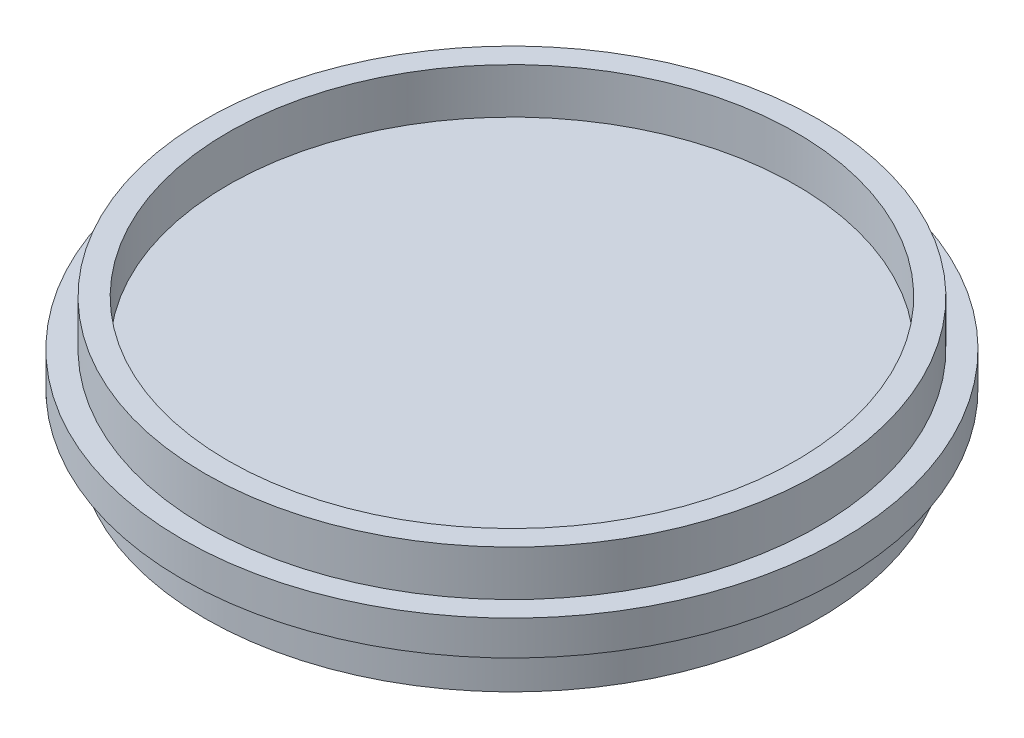
from build123d import *

# Parameters (mm, degrees)
SKETCH1_R           = 92.075
BOSS_EXTRUDE1_DEPTH = 4.826
SKETCH4_R           = 85.725
SKETCH4_R_2         = 79.375
BOSS_EXTRUDE2_DEPTH = 12.7


with BuildPart() as part:
    # Sketch1 → Boss-Extrude1 (new, symmetric)
    with BuildSketch(Plane(origin=(0, 0, 0), x_dir=(1, 0, 0), z_dir=(0, 1, 0))):
        with Locations(Location((0, 0, 0), (0, 0, 270))):
            Circle(SKETCH1_R)
    extrude(amount=BOSS_EXTRUDE1_DEPTH, both=True)

    # Sketch4 → Boss-Extrude2 (add)
    with BuildSketch(Plane(origin=(0, 4.826, 0), x_dir=(1, 0, 0), z_dir=(0, 1, 0))):
        with Locations(Location((0, 0, 0), (0, 0, 270))):
            Circle(SKETCH4_R)
        with Locations(Location((0, 0, 0), (0, 0, 270))):
            Circle(SKETCH4_R_2, mode=Mode.SUBTRACT)
    boss_extrude2 = extrude(amount=BOSS_EXTRUDE2_DEPTH)

    # Mirror2: Boss-Extrude2 across plane
    add(boss_extrude2.mirror(Plane.ZX))


solid = part.part
